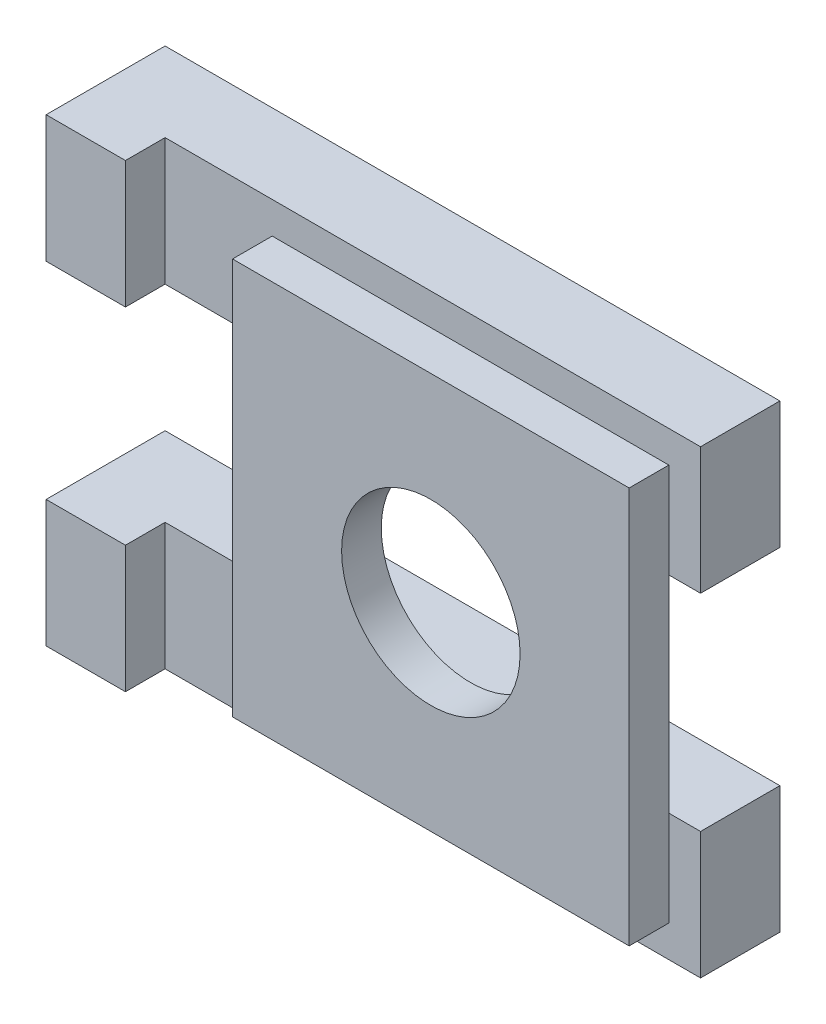
from build123d import *

# Parameters (mm, degrees)
SZKIC1_W                    = 100
SZKIC1_H                    = 100
SZKIC1_R                    = 22.5
DODANIE_WYCI_GNI_CIE1_DEPTH = 10
SZKIC2_W                    = 155
SZKIC2_H                    = 32
DODANIE_WYCI_GNI_CIE2_DEPTH = 20
SZKIC3_W                    = 20
SZKIC3_H                    = 32
DODANIE_WYCI_GNI_CIE3_DEPTH = 10


with BuildPart() as part:
    # Szkic1 → Dodanie-wyciągnięcie1 (new body)
    with BuildSketch(Plane.XY):
        Rectangle(SZKIC1_W, SZKIC1_H)
        Circle(SZKIC1_R, mode=Mode.SUBTRACT)
    extrude(amount=DODANIE_WYCI_GNI_CIE1_DEPTH)

    # Szkic2 → Dodanie-wyciągnięcie2 (add)
    with BuildSketch(Plane(origin=(0, 0, 0), x_dir=(-1, 0, 0), z_dir=(0, 0, -1))):
        with Locations((19.5, 42)):
            Rectangle(SZKIC2_W, SZKIC2_H)
        with Locations((19.5, -42)):
            Rectangle(SZKIC2_W, SZKIC2_H)
    extrude(amount=DODANIE_WYCI_GNI_CIE2_DEPTH)

    # Szkic3 → Dodanie-wyciągnięcie3 (add)
    with BuildSketch(Plane.XY):
        with Locations((-87, 42)):
            Rectangle(SZKIC3_W, SZKIC3_H)
        with Locations((-87, -42)):
            Rectangle(SZKIC3_W, SZKIC3_H)
    extrude(amount=DODANIE_WYCI_GNI_CIE3_DEPTH)


solid = part.part
